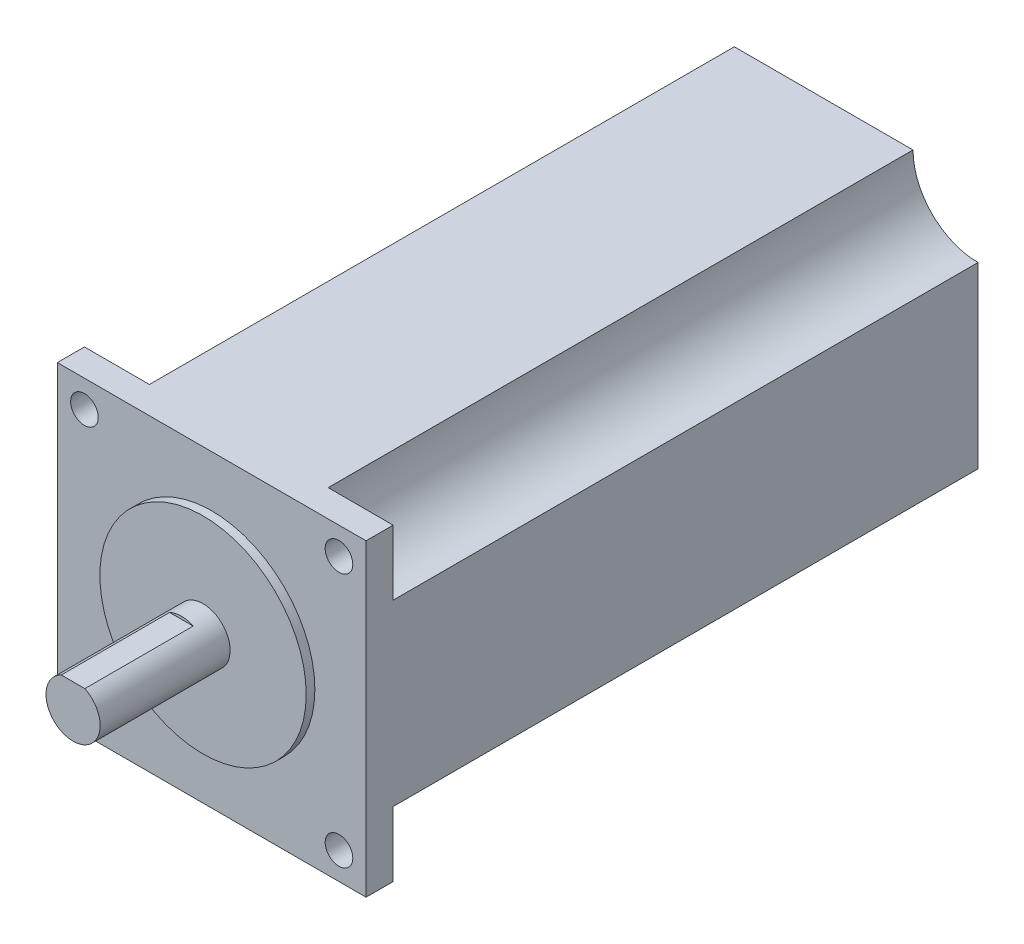
from build123d import *

# Parameters (mm, degrees)
ESQUISSE1_W        = 57
ESQUISSE1_H        = 57
ESQUISSE1_R        = 2.55
BOSS_EXTRU_1_DEPTH = 5
BOSS_EXTRU_2_DEPTH = 108
ESQUISSE3_R        = 19.05
BOSS_EXTRU_3_DEPTH = 1.6
ESQUISSE4_R        = 5
BOSS_EXTRU_4_DEPTH = 4
BOSS_EXTRU_5_DEPTH = 20


with BuildPart() as part:
    # Esquisse1 → Boss.-Extru.1 (new body)
    with BuildSketch(Plane.XY):
        with Locations((-10.354214819, -23.958965641)):
            Rectangle(ESQUISSE1_W, ESQUISSE1_H)
        with Locations((-33.854214819, -0.458965641)):
            Circle(ESQUISSE1_R, mode=Mode.SUBTRACT)
        with Locations((13.145785181, -0.458965641)):
            Circle(ESQUISSE1_R, mode=Mode.SUBTRACT)
        with Locations((13.145785181, -47.458965641)):
            Circle(ESQUISSE1_R, mode=Mode.SUBTRACT)
        with Locations((-33.854214819, -47.458965641)):
            Circle(ESQUISSE1_R, mode=Mode.SUBTRACT)
    extrude(amount=BOSS_EXTRU_1_DEPTH)

    # Esquisse2 → Boss.-Extru.2 (add)
    with BuildSketch(Plane(origin=(0, 0, 0), x_dir=(-1, 0, 0), z_dir=(0, 0, -1))):
        with BuildLine():
            Line((-6.145785181, 4.541034359), (26.854214819, 4.541034359))
            ThreePointArc((26.854214819, 4.541034359), (30.368933444, -3.944247016), (38.854214819, -7.458965641))
            Line((38.854214819, -7.458965641), (38.854214819, -40.458965641))
            ThreePointArc((38.854214819, -40.458965641), (30.368933444, -43.973684267), (26.854214819, -52.458965641))
            Line((26.854214819, -52.458965641), (-6.145785181, -52.458965641))
            ThreePointArc((-6.145785181, -52.458965641), (-9.660503807, -43.973684267), (-18.145785181, -40.458965641))
            Line((-18.145785181, -40.458965641), (-18.145785181, -7.458965641))
            ThreePointArc((-18.145785181, -7.458965641), (-9.660503807, -3.944247016), (-6.145785181, 4.541034359))
        make_face()
    extrude(amount=BOSS_EXTRU_2_DEPTH)

    # Esquisse3 → Boss.-Extru.3 (add)
    with BuildSketch(Plane.XY.offset(5)):
        with Locations((-10.354214819, -23.958965641)):
            Circle(ESQUISSE3_R)
    extrude(amount=BOSS_EXTRU_3_DEPTH)

    # Esquisse4 → Boss.-Extru.4 (add)
    with BuildSketch(Plane.XY.offset(6.6)):
        with Locations((-10.354214819, -23.958965641)):
            Circle(ESQUISSE4_R)
    extrude(amount=BOSS_EXTRU_4_DEPTH)

    # Esquisse5 → Boss.-Extru.5 (add)
    with BuildSketch(Plane.XY.offset(10.6)):
        with BuildLine():
            Line((-12.53366429, -19.458965641), (-8.174765347, -19.458965641))
            ThreePointArc((-8.174765347, -19.458965641), (-10.354214819, -28.958965641), (-12.53366429, -19.458965641))
        make_face()
    extrude(amount=BOSS_EXTRU_5_DEPTH)


solid = part.part
